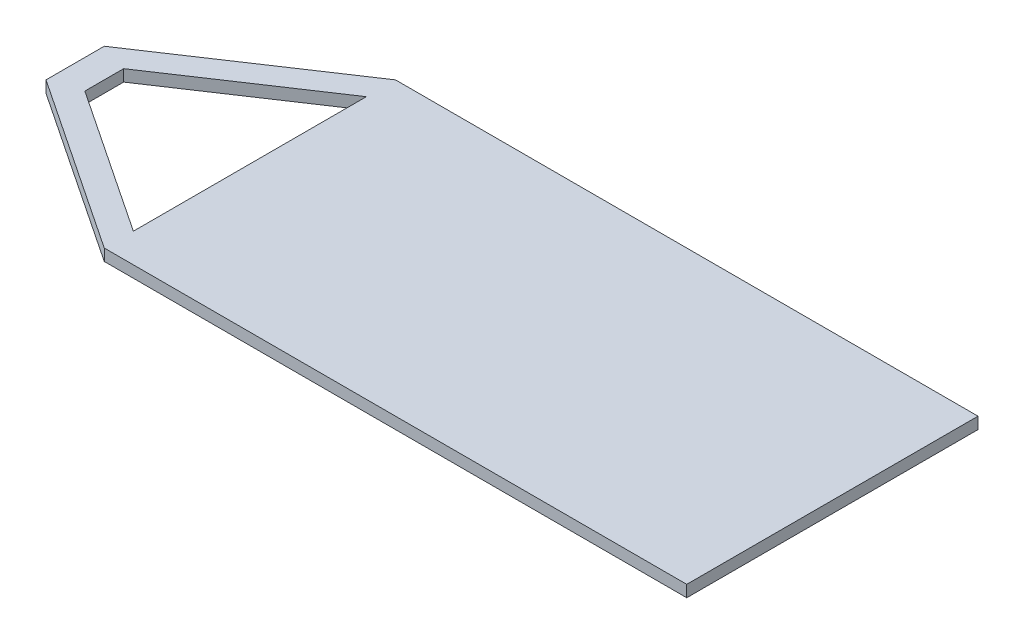
from build123d import *

# Parameters (mm, degrees)
BOSS_EXTRUDE1_DEPTH = 2


with BuildPart() as part:
    # Sketch1 → Boss-Extrude1 (new body)
    with BuildSketch(Plane(origin=(0, 0, 0), x_dir=(1, 0, 0), z_dir=(0, 1, 0))):
        Polygon((0, 5), (30, 25), (130, 25), (130, -25), (30, -25), (0, -5), align=None)
        Polygon((30, -20), (30, 20), (5, 3.333333333), (5, -3.333333333), align=None, mode=Mode.SUBTRACT)
    extrude(amount=BOSS_EXTRUDE1_DEPTH)


solid = part.part
